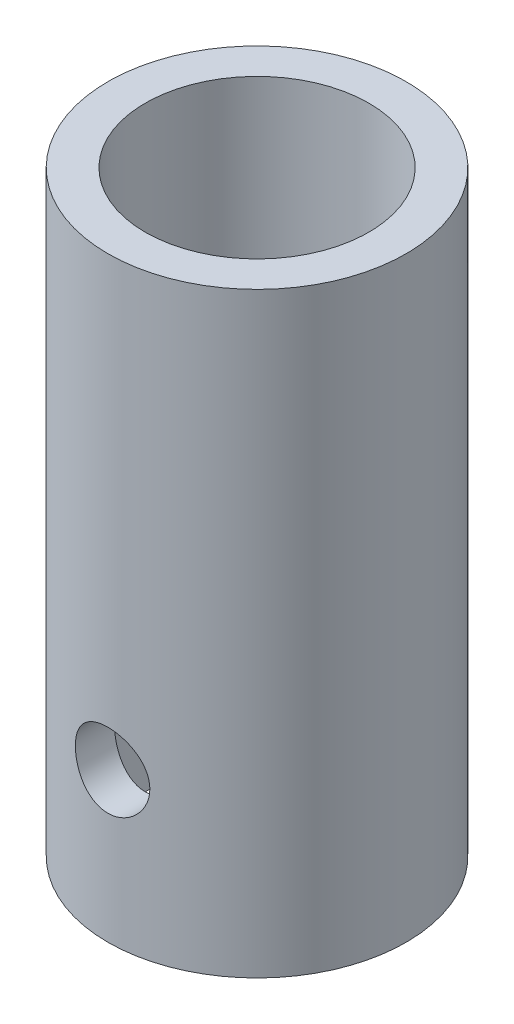
from build123d import *

# Parameters (mm, degrees)
SKETCH1_R                        = 6.35
BOSS_EXTRUDE1_DEPTH              = 25.4
SKETCH3_R                        = 4.7625
CUT_EXTRUDE1_DEPTH               = 27.940768363
F_1_8_0_125_DIAMETER_HOLE2_D     = 3.175
F_1_8_0_125_DIAMETER_HOLE2_DEPTH = 6.349
F_1_8_0_125_DIAMETER_HOLE2_TIP   = 0.953866233


with BuildPart() as part:
    # Sketch1 → Boss-Extrude1 (new body)
    with BuildSketch(Plane(origin=(0, 0, 0), x_dir=(1, 0, 0), z_dir=(0, 1, 0))):
        with Locations(Location((0, 0, 0), (0, 0, 270))):
            Circle(SKETCH1_R)
    extrude(amount=BOSS_EXTRUDE1_DEPTH)

    # Sketch3 → Cut-Extrude1 (cut, through all)
    with BuildSketch(Plane(origin=(0, 25.4, 0), x_dir=(1, 0, 0), z_dir=(0, 1, 0))):
        with Locations(Location((0, 0, 0), (0, 0, 270))):
            Circle(SKETCH3_R)
    extrude(amount=-CUT_EXTRUDE1_DEPTH, mode=Mode.SUBTRACT)

    # 1/8 (0.125) Diameter Hole2
    with Locations(Plane(origin=(-0.004002873, 6.346663359, 6.349998738), x_dir=(0.999999801314, 0, 0.000630373746), z_dir=(-0.000630373746, 0, 0.999999801314))):
        with Locations((0, 0)):
            Hole(F_1_8_0_125_DIAMETER_HOLE2_D / 2, depth=F_1_8_0_125_DIAMETER_HOLE2_DEPTH)
            with Locations((0, 0, -(F_1_8_0_125_DIAMETER_HOLE2_DEPTH + F_1_8_0_125_DIAMETER_HOLE2_TIP / 2))):  # 118° drill point
                Cone(0, F_1_8_0_125_DIAMETER_HOLE2_D / 2, F_1_8_0_125_DIAMETER_HOLE2_TIP, mode=Mode.SUBTRACT)


solid = part.part
